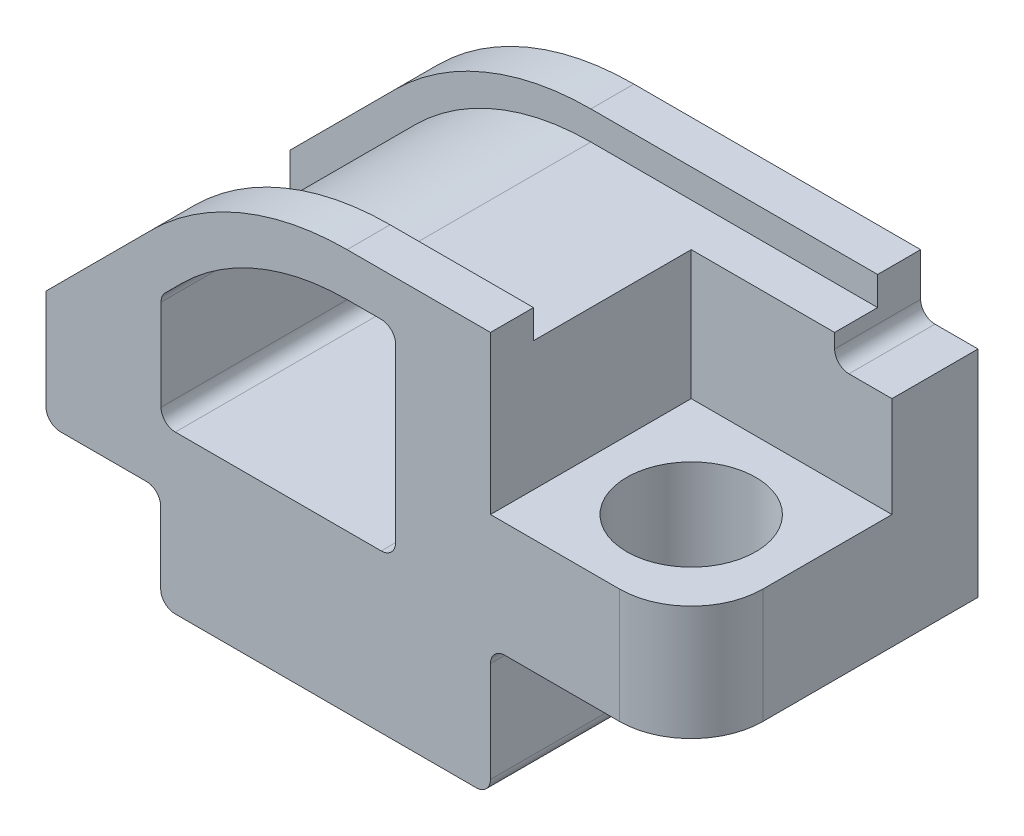
from build123d import *

# Parameters (mm, degrees)
BOSS_EXTRUDE1_DEPTH = 1270
CUT_EXTRUDE2_DEPTH  = 6799.949477677
CUT_EXTRUDE3_DEPTH  = 889
SKETCH5_W           = 1778
SKETCH5_H           = 1778
CUT_EXTRUDE4_DEPTH  = 1397
SKETCH6_R           = 571.5
CUT_EXTRUDE5_DEPTH  = 6240.824196241
FILLET1_R           = 635
FILLET2_R           = 127
FILLET3_R           = 127


with BuildPart() as part:
    # Sketch1 → Boss-Extrude1 (new, symmetric)
    with BuildSketch(Plane.XY):
        with BuildLine():
            Line((0, 0), (1016, 0))
            Line((1016, 0), (1016, -889))
            Line((1016, -889), (3937, -889))
            Line((3937, -889), (3937, 254))
            Line((3937, 254), (5715, 254))
            Line((5715, 254), (5715, 2159))
            Line((5715, 2159), (5207, 2159))
            Line((5207, 2159), (5207, 2667))
            Line((5207, 2667), (2667, 2667))
            ThreePointArc((2667, 2667), (1728.338394969, 2480.288597975), (932.579510314, 1948.579510314))
            Line((932.579510314, 1948.579510314), (0, 1016))
            Line((0, 1016), (0, 0))
        make_face()
    extrude(amount=BOSS_EXTRUDE1_DEPTH, both=True)

    # Sketch3 → Cut-Extrude2 (cut, through all)
    with BuildSketch(Plane.XY.offset(1270)):
        with BuildLine():
            Line((3096.26, 2283.46), (2667, 2283.46))
            ThreePointArc((2667, 2283.46), (1875.112798618, 2125.943842075), (1203.783245171, 1677.375775458))
            Line((1203.783245171, 1677.375775458), (1018.54, 1492.132530287))
            Line((1018.54, 1492.132530287), (1018.54, 506.947897552))
            Line((1018.54, 506.947897552), (3096.26, 506.947897552))
            Line((3096.26, 506.947897552), (3096.26, 2283.46))
        make_face()
    extrude(amount=-CUT_EXTRUDE2_DEPTH, mode=Mode.SUBTRACT)

    # Sketch4 → Cut-Extrude3 (cut, symmetric)
    with BuildSketch(Plane.XY):
        with BuildLine():
            Line((5207, 2413), (2667, 2413))
            ThreePointArc((2667, 2413), (1825.539986789, 2245.623196717), (1112.184632736, 1768.974387893))
            Line((1112.184632736, 1768.974387893), (0, 656.789755157))
            Line((0, 656.789755157), (0, 1016))
            Line((0, 1016), (932.579510314, 1948.579510314))
            ThreePointArc((932.579510314, 1948.579510314), (1728.338394969, 2480.288597975), (2667, 2667))
            Line((2667, 2667), (5207, 2667))
            Line((5207, 2667), (5207, 2413))
        make_face()
    extrude(amount=CUT_EXTRUDE3_DEPTH, both=True, mode=Mode.SUBTRACT)

    # Sketch5 → Cut-Extrude4 (cut)
    with BuildSketch(Plane(origin=(0, 2667, 0), x_dir=(1, 0, 0), z_dir=(0, 1, 0))):
        with Locations((4826, -381)):
            Rectangle(SKETCH5_W, SKETCH5_H)
    extrude(amount=-CUT_EXTRUDE4_DEPTH, mode=Mode.SUBTRACT)

    # Sketch6 → Cut-Extrude5 (cut, through all)
    with BuildSketch(Plane(origin=(0, 1270, 0), x_dir=(1, 0, 0), z_dir=(0, 1, 0))):
        with Locations(Location((4826, -381, 0), (0, 0, 270))):
            Circle(SKETCH6_R)
    extrude(amount=-CUT_EXTRUDE5_DEPTH, mode=Mode.SUBTRACT)

    # Fillet1
    fillet1_edges = [part.edges().sort_by_distance(p)[0] for p in [
        (5715, 762, 1270),
    ]]
    fillet(fillet1_edges, radius=FILLET1_R)

    # Fillet2
    fillet2_edges = [part.edges().sort_by_distance(p)[0] for p in [
        (3937, 254, 0),
        (3937, -889, 0),
        (1016, -889, 0),
        (1016, 0, 0),
        (0, 0, 0),
        (5207, 2159, -889),
    ]]
    fillet(fillet2_edges, radius=FILLET2_R)

    # Fillet3
    fillet3_edges = [part.edges().sort_by_distance(p)[0] for p in [
        (3096.26, 2283.46, 0),
        (3096.26, 506.947897552, 0),
        (1018.54, 506.947897552, 0),
        (1018.54, 1492.132530287, 0),
    ]]
    fillet(fillet3_edges, radius=FILLET3_R)


solid = part.part
